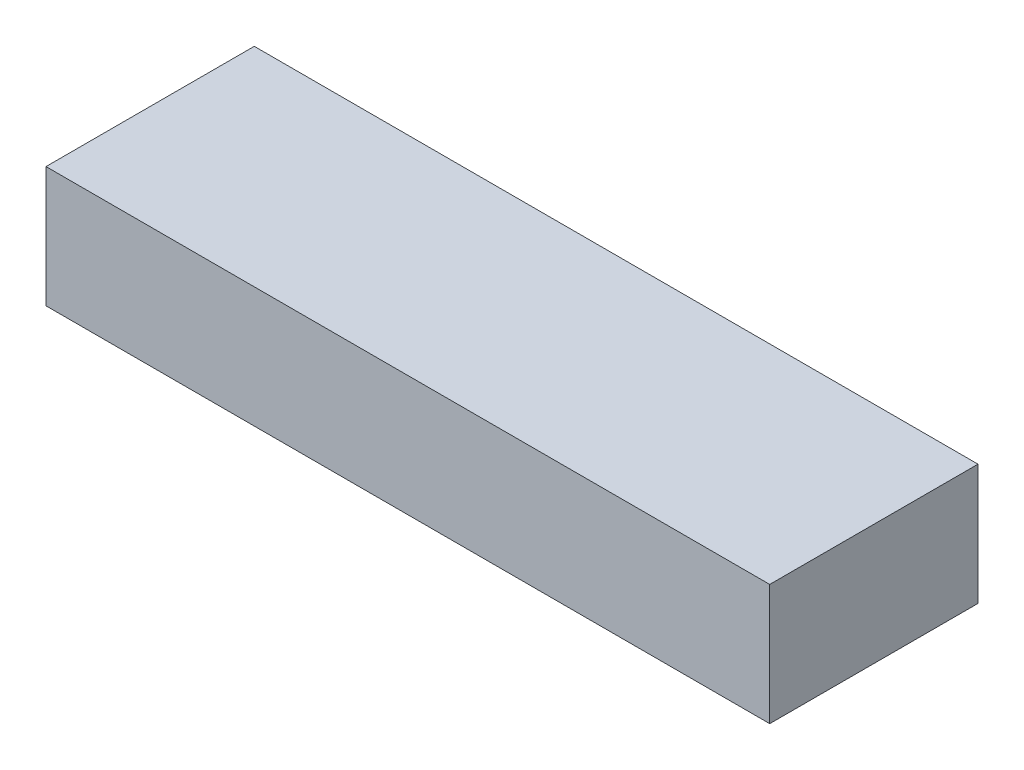
from build123d import *

# Parameters (mm, degrees)
SKETCH1_W           = 18
SKETCH1_H           = 5.18
BOSS_EXTRUDE1_DEPTH = 3


with BuildPart() as part:
    # Sketch1 → Boss-Extrude1 (new body)
    with BuildSketch(Plane(origin=(0, 0, 0), x_dir=(1, 0, 0), z_dir=(0, 1, 0))):
        with Locations((9, 2.59)):
            Rectangle(SKETCH1_W, SKETCH1_H)
    extrude(amount=BOSS_EXTRUDE1_DEPTH)


solid = part.part
